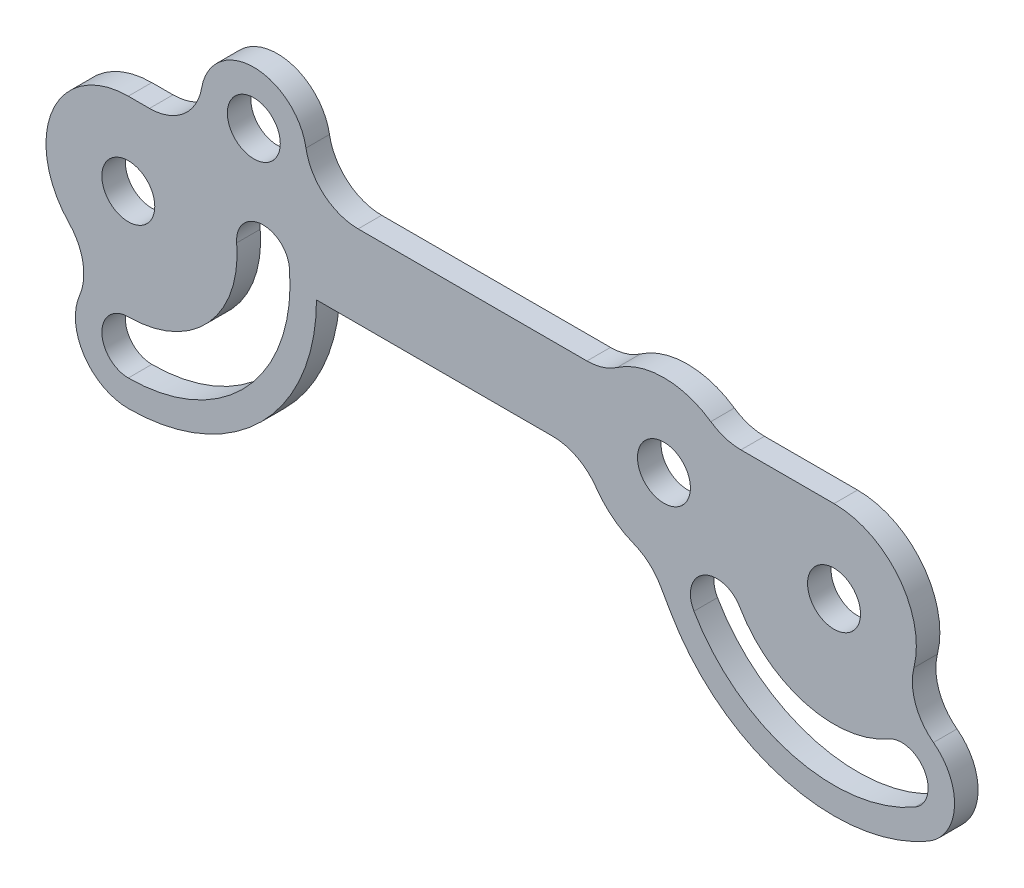
from build123d import *

# Parameters (mm, degrees)
SKETCH1_R           = 1.7859375
BOSS_EXTRUDE1_DEPTH = 1.5875
FILLET1_R           = 3.571875


with BuildPart() as part:
    # Sketch1 → Boss-Extrude1 (new body)
    with BuildSketch(Plane.XY):
        with BuildLine():
            ThreePointArc((53.975, -10.998522628), (55.282397014, -6.119250683), (50.403125088, -4.811853599))
            ThreePointArc((50.403125088, -4.811853599), (52.991925359, 1.438063368), (47.625, 5.55625))
            Line((47.625, 5.55625), (40.072011619, 5.55625))
            ThreePointArc((40.072011619, 5.55625), (36.147936861, 7.178856478), (32.223862103, 5.55625))
            Line((32.223862103, 5.55625), (11.155561342, 5.55625))
            ThreePointArc((11.155561342, 5.55625), (8.470770891, 11.484009389), (5.785980441, 5.55625))
            Line((5.785980441, 5.55625), (0, 5.55625))
            ThreePointArc((0, 5.55625), (-5.55625, 0), (0, -5.55625))
            ThreePointArc((0, -5.55625), (-3.571875, -9.128125), (0, -12.7))
            ThreePointArc((0, -12.7), (8.980256121, -8.980256121), (12.7, 0))
            Line((12.7, 0), (30.833892989, 0))
            ThreePointArc((30.833892989, 0), (32.465327803, -2.537958939), (35.182607485, -3.849143997))
            Line((35.182607485, -3.849143997), (36.626477372, -6.35))
            ThreePointArc((36.626477372, -6.35), (44.337998127, -12.267257994), (53.975, -10.998522628))
        make_face()
        with BuildLine():
            ThreePointArc((0, -10.9140625), (-1.7859375, -9.128125), (0, -7.3421875))
            ThreePointArc((0, -7.3421875), (5.413228446, -4.960309977), (7.31424826, 0.639913805))
            ThreePointArc((7.31424826, 0.639913805), (8.937735019, 2.574709983), (10.872531197, 0.951223224))
            ThreePointArc((10.872531197, 0.951223224), (8.046690934, -7.37343375), (0, -10.9140625))
        make_face(mode=Mode.SUBTRACT)
        with BuildLine():
            ThreePointArc((51.29609375, -6.358520894), (53.735729745, -7.012219389), (53.08203125, -9.451855383))
            ThreePointArc((53.08203125, -9.451855383), (44.800232766, -10.542174838), (38.173144617, -5.45703125))
            ThreePointArc((38.173144617, -5.45703125), (38.826843111, -3.017395255), (41.266479106, -3.67109375))
            ThreePointArc((41.266479106, -3.67109375), (45.724702042, -7.092008528), (51.29609375, -6.358520894))
        make_face(mode=Mode.SUBTRACT)
        Circle(SKETCH1_R, mode=Mode.SUBTRACT)
        with Locations((8.470770891, 7.912134389)):
            Circle(SKETCH1_R, mode=Mode.SUBTRACT)
        with Locations((36.147936861, 1.622606478)):
            Circle(SKETCH1_R, mode=Mode.SUBTRACT)
        with Locations((47.625, 0)):
            Circle(SKETCH1_R, mode=Mode.SUBTRACT)
    extrude(amount=BOSS_EXTRUDE1_DEPTH)

    # Fillet1
    fillet1_edges = [part.edges().sort_by_distance(p)[0] for p in [
        (5.785980441, 5.55625, 0.79375),
        (11.155561342, 5.55625, 0.79375),
        (32.223862103, 5.55625, 0.79375),
        (40.072011619, 5.55625, 0.79375),
        (50.403125088, -4.811853599, 0.79375),
        (35.182607485, -3.849143997, 0.79375),
        (30.833892989, 0, 0.79375),
        (0, -5.55625, 0.79375),
    ]]
    fillet(fillet1_edges, radius=FILLET1_R)


solid = part.part
